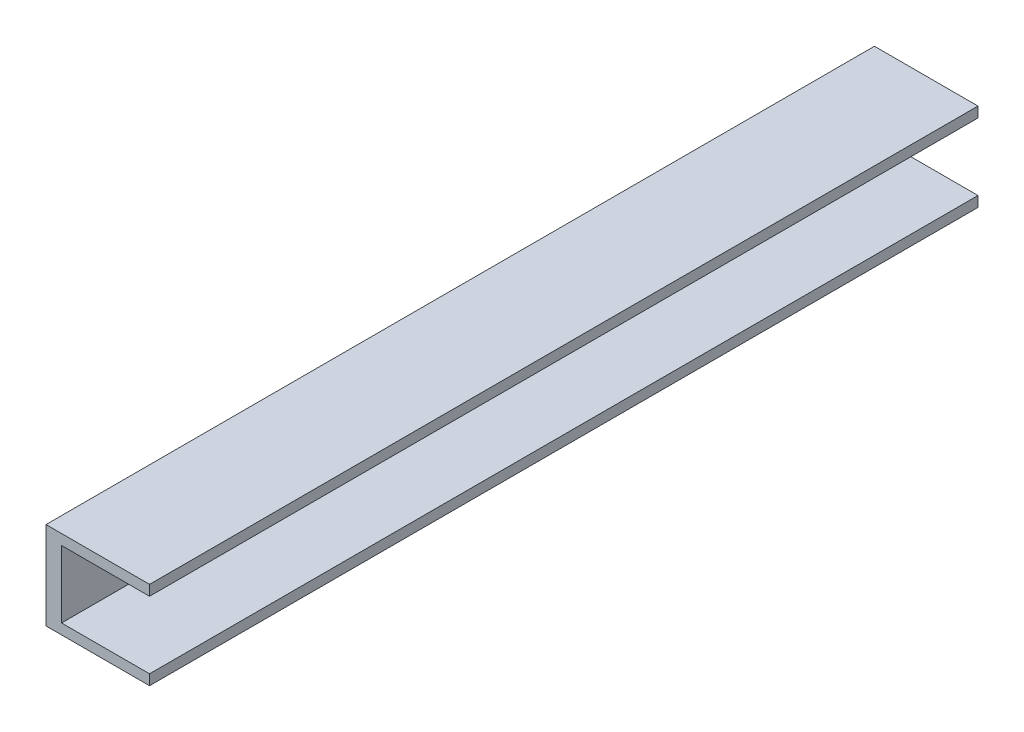
from build123d import *

# Parameters (mm, degrees)
BASECHANNELSE_DEPTH = 127


with BuildPart() as part:
    # Sketch1 → BaseChannelse (new, symmetric)
    with BuildSketch(Plane.XY):
        with BuildLine():
            Line((0, 0), (0, 26.924))
            Line((0, 26.924), (31.75, 26.924))
            Line((31.75, 26.924), (31.75, 23.749))
            Line((31.75, 23.749), (4.76504, 23.749))
            ThreePointArc((4.76504, 23.749), (4.763243949, 23.748256051), (4.7625, 23.74646))
            Line((4.7625, 23.74646), (4.7625, 3.17754))
            ThreePointArc((4.7625, 3.17754), (4.763243949, 3.175743949), (4.76504, 3.175))
            Line((4.76504, 3.175), (31.75, 3.175))
            Line((31.75, 3.175), (31.75, 0))
            Line((31.75, 0), (0, 0))
        make_face()
    extrude(amount=BASECHANNELSE_DEPTH, both=True)


solid = part.part
